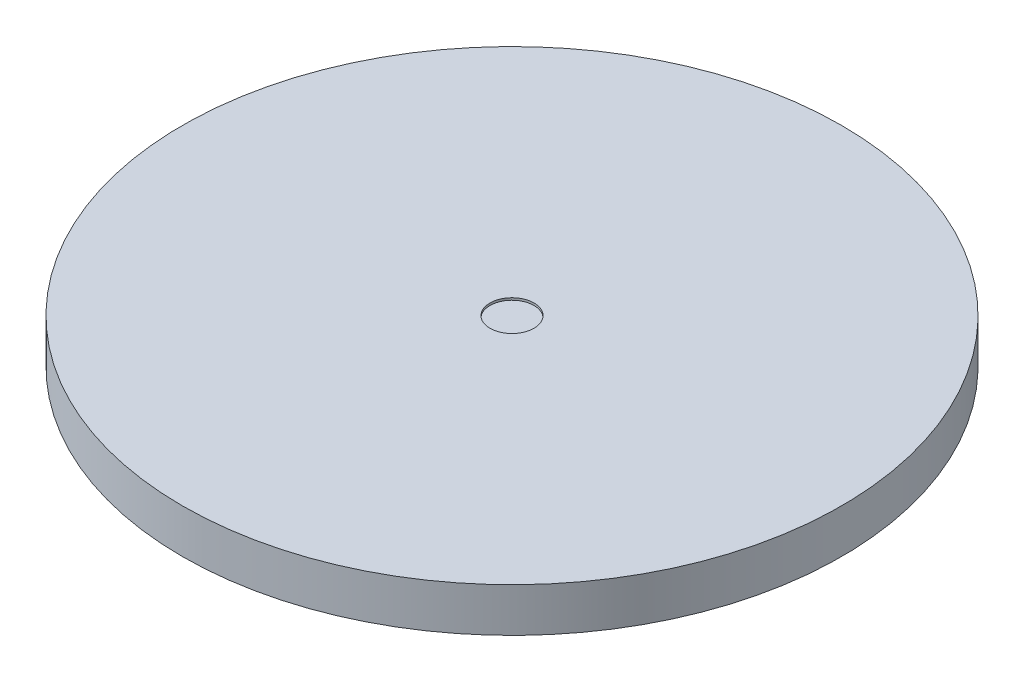
from build123d import *

# Parameters (mm, degrees)
SKETCH1_R           = 30
BOSS_EXTRUDE1_DEPTH = 4
SKETCH2_R           = 2
CUT_EXTRUDE1_DEPTH  = 0.2


with BuildPart() as part:
    # Sketch1 → Boss-Extrude1 (new body)
    with BuildSketch(Plane(origin=(0, 0, 0), x_dir=(1, 0, 0), z_dir=(0, 1, 0))):
        with Locations(Location((0, 0, 0), (0, 0, 270))):
            Circle(SKETCH1_R)
    extrude(amount=BOSS_EXTRUDE1_DEPTH)

    # Sketch2 → Cut-Extrude1 (cut)
    with BuildSketch(Plane(origin=(0, 4, 0), x_dir=(1, 0, 0), z_dir=(0, 1, 0))):
        with Locations(Location((0, 0, 0), (0, 0, 270))):
            Circle(SKETCH2_R)
    extrude(amount=-CUT_EXTRUDE1_DEPTH, mode=Mode.SUBTRACT)


solid = part.part
